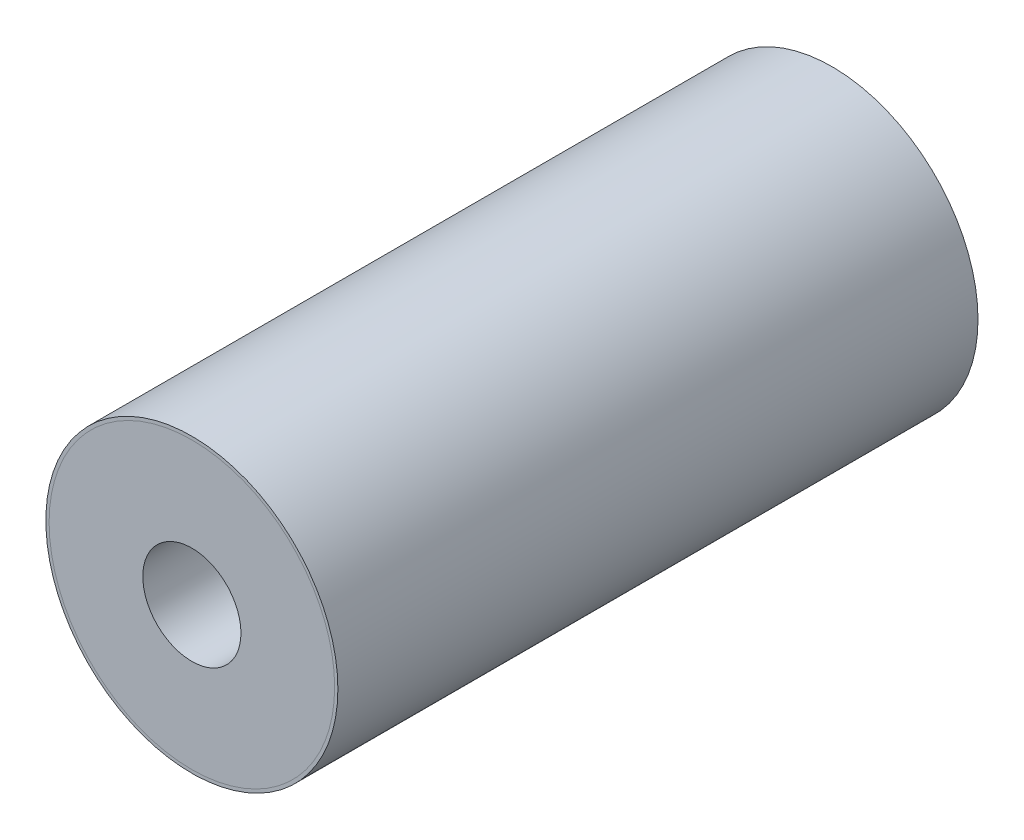
from build123d import *

# Parameters (mm, degrees)
SKETCH1_R           = 16.5481
SKETCH1_R_2         = 16.1798
BOSS_EXTRUDE1_DEPTH = 72.5424
SKETCH2_R           = 16.1798
BOSS_EXTRUDE2_DEPTH = 72.5424
SKETCH4_W           = 5.5626
SKETCH4_H           = 72.5424


with BuildPart() as part:
    # Sketch1 → Boss-Extrude1 (new body)
    with BuildSketch(Plane.XY):
        Circle(SKETCH1_R)
        Circle(SKETCH1_R_2, mode=Mode.SUBTRACT)
    extrude(amount=BOSS_EXTRUDE1_DEPTH)


with BuildPart() as body_2:
    # Sketch2 → Boss-Extrude2 (new body)
    with BuildSketch(Plane.XY):
        Circle(SKETCH2_R)
    extrude(amount=BOSS_EXTRUDE2_DEPTH)

    # Sketch4 → 7/16 (0.438) Diameter Hole1 (revolve, cut)
    with BuildSketch(Plane(origin=(0, 0, 72.5424), x_dir=(0, -1, 0), z_dir=(1, 0, 0))):
        with Locations((2.7813, 36.2712)):
            Rectangle(SKETCH4_W, SKETCH4_H)
    revolve(axis=Axis((0, 0, 78.8924), (0, 0, -1)), mode=Mode.SUBTRACT)


solid = Compound([part.part, body_2.part])
